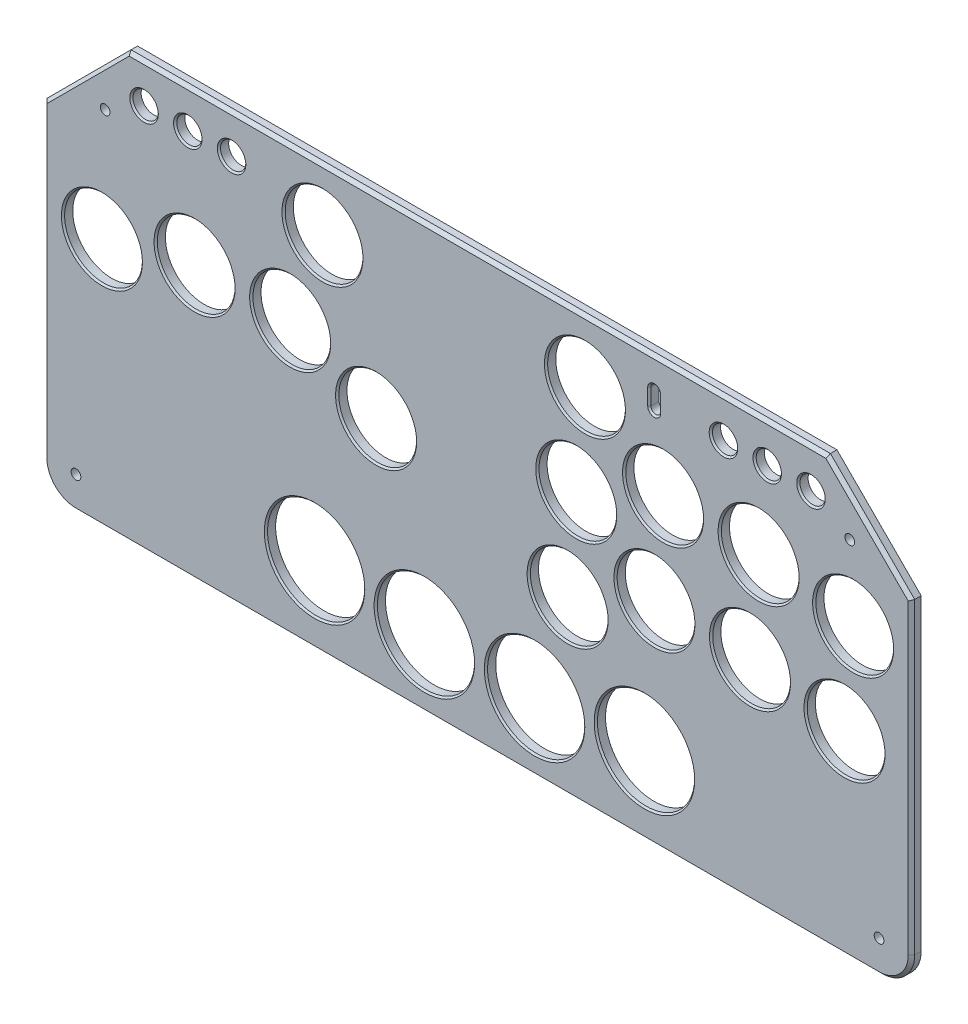
from build123d import *

# Parameters (mm, degrees)
BOSS_EXTRUDE1_DEPTH   = 3
SKETCH24_R            = 3.9
CUT_EXTRUDE2_DEPTH    = 307.167536128
SKETCH1_R             = 12
SKETCH1_R_2           = 15
CUT_EXTRUDE3_DEPTH    = 307.167536128
F_3_0MM_DOWEL_HOLE1_D = 3
CHAMFER1_SIZE         = 1
CHAMFER2_SIZE         = 0.5


with BuildPart() as part:
    # Sketch2 → Boss-Extrude1 (new body)
    with BuildSketch(Plane.XY):
        with BuildLine():
            Line((6.41186441, 110.238694526), (6.41186441, 15.286374556))
            ThreePointArc((6.41186441, 15.286374556), (9.340796598, 8.215306744), (16.41186441, 5.286374556))
            Line((16.41186441, 5.286374556), (264.168886442, 5.286374556))
            ThreePointArc((264.168886442, 5.286374556), (271.239954254, 8.215306744), (274.168886442, 15.286374556))
            Line((274.168886442, 15.286374556), (274.168886442, 110.238694526))
            Line((274.168886442, 110.238694526), (248.168886442, 136.238694526))
            Line((248.168886442, 136.238694526), (32.41186441, 136.238694526))
            Line((32.41186441, 136.238694526), (6.41186441, 110.238694526))
        make_face()
    extrude(amount=-BOSS_EXTRUDE1_DEPTH)

    # Sketch24 → Cut-Extrude2 (cut, through all)
    with BuildSketch(Plane.XY):
        with Locations((37.41186441, 124.238694526)):
            Circle(SKETCH24_R)
        with Locations((50.91186441, 124.238694526)):
            Circle(SKETCH24_R)
        with Locations((64.41186441, 124.238694526)):
            Circle(SKETCH24_R)
        with Locations((216.168886442, 124.238694526)):
            Circle(SKETCH24_R)
        with Locations((229.668886442, 124.238694526)):
            Circle(SKETCH24_R)
        with Locations((243.168886442, 124.238694526)):
            Circle(SKETCH24_R)
        with BuildLine():
            Line((193.298949614, 126.738694526), (193.298949614, 121.738694526))
            ThreePointArc((193.298949614, 121.738694526), (194.798949614, 120.238694526), (196.298949614, 121.738694526))
            Line((196.298949614, 121.738694526), (196.298949614, 126.738694526))
            ThreePointArc((196.298949614, 126.738694526), (194.798949614, 128.238694526), (193.298949614, 126.738694526))
        make_face()
    extrude(amount=-CUT_EXTRUDE2_DEPTH, mode=Mode.SUBTRACT)

    # Sketch1 → Cut-Extrude3 (cut, through all)
    with BuildSketch(Plane.XY):
        with Locations((24.41186441, 82.179064133)):
            Circle(SKETCH1_R)
        with Locations((52.996556322, 89.470524089)):
            Circle(SKETCH1_R)
        with Locations((92.45540719, 117.238694526)):
            Circle(SKETCH1_R)
        with Locations((82.496556322, 89.470524089)):
            Circle(SKETCH1_R)
        with Locations((109.001946024, 76.520067852)):
            Circle(SKETCH1_R)
        with Locations((168.091946024, 58.360067852)):
            Circle(SKETCH1_R)
        with Locations((194.873540874, 70.729230202)):
            Circle(SKETCH1_R)
        with Locations((224.358659158, 69.792320505)):
            Circle(SKETCH1_R)
        with Locations((253.510608286, 65.274150291)):
            Circle(SKETCH1_R)
        with Locations((256.168886442, 94.654135948)):
            Circle(SKETCH1_R)
        with Locations((227.016937315, 99.172306162)):
            Circle(SKETCH1_R)
        with Locations((197.531819031, 100.10921586)):
            Circle(SKETCH1_R)
        with Locations((170.75022418, 87.740053509)):
            Circle(SKETCH1_R)
        with Locations((191.774681199, 29.091460603)):
            Circle(SKETCH1_R_2)
        with Locations((157.891946024, 26.270067852)):
            Circle(SKETCH1_R_2)
        with Locations((123.891946024, 26.270067852)):
            Circle(SKETCH1_R_2)
        with Locations((90.009210849, 29.091460603)):
            Circle(SKETCH1_R_2)
        with Locations((173.429012786, 117.118176179)):
            Circle(SKETCH1_R)
    extrude(amount=-CUT_EXTRUDE3_DEPTH, mode=Mode.SUBTRACT)

    # Ø3.0mm Dowel Hole1 (through all)
    with Locations(Plane.XY):
        with Locations((25.42227205, 117.228286886), (16.41186441, 15.286374556), (264.168886442, 15.286374556), (255.158478802, 117.228286886)):
            Hole(F_3_0MM_DOWEL_HOLE1_D / 2)

    # Chamfer1
    chamfer1_edges = [part.edges().sort_by_distance(p)[0] for p in [
        (274.168886442, 62.762534541, 0),
        (271.239954254, 8.215306744, 0),
        (140.290375426, 5.286374556, 0),
        (9.340796598, 8.215306744, 0),
        (261.168886442, 123.238694526, 0),
        (140.290375426, 136.238694526, 0),
        (6.41186441, 62.762534541, 0),
        (19.41186441, 123.238694526, 0),
    ]]
    chamfer(chamfer1_edges, length=CHAMFER1_SIZE)

    # Chamfer2
    chamfer2_edges = [part.edges().sort_by_distance(p)[0] for p in [
        (239.268886442, 124.238694526, 0),
        (225.768886442, 124.238694526, 0),
        (212.268886442, 124.238694526, 0),
        (193.298949614, 124.238694526, 0),
        (194.798949614, 120.238694526, 0),
        (194.798949614, 128.238694526, 0),
        (196.298949614, 124.238694526, 0),
        (60.51186441, 124.238694526, 0),
        (47.01186441, 124.238694526, 0),
        (33.51186441, 124.238694526, 0),
        (161.429012786, 117.118176179, 0),
        (244.168886442, 94.654135948, 0),
        (215.016937315, 99.172306162, 0),
        (185.531819031, 100.10921586, 0),
        (158.75022418, 87.740053509, 0),
        (182.873540874, 70.729230202, 0),
        (212.358659158, 69.792320505, 0),
        (241.510608286, 65.274150291, 0),
        (176.774681199, 29.091460603, 0),
        (156.091946024, 58.360067852, 0),
        (142.891946024, 26.270067852, 0),
        (108.891946024, 26.270067852, 0),
        (97.001946024, 76.520067852, 0),
        (75.009210849, 29.091460603, 0),
        (80.45540719, 117.238694526, 0),
        (70.496556322, 89.470524089, 0),
        (40.996556322, 89.470524089, 0),
        (12.41186441, 82.179064133, 0),
    ]]
    chamfer(chamfer2_edges, length=CHAMFER2_SIZE)


solid = part.part
